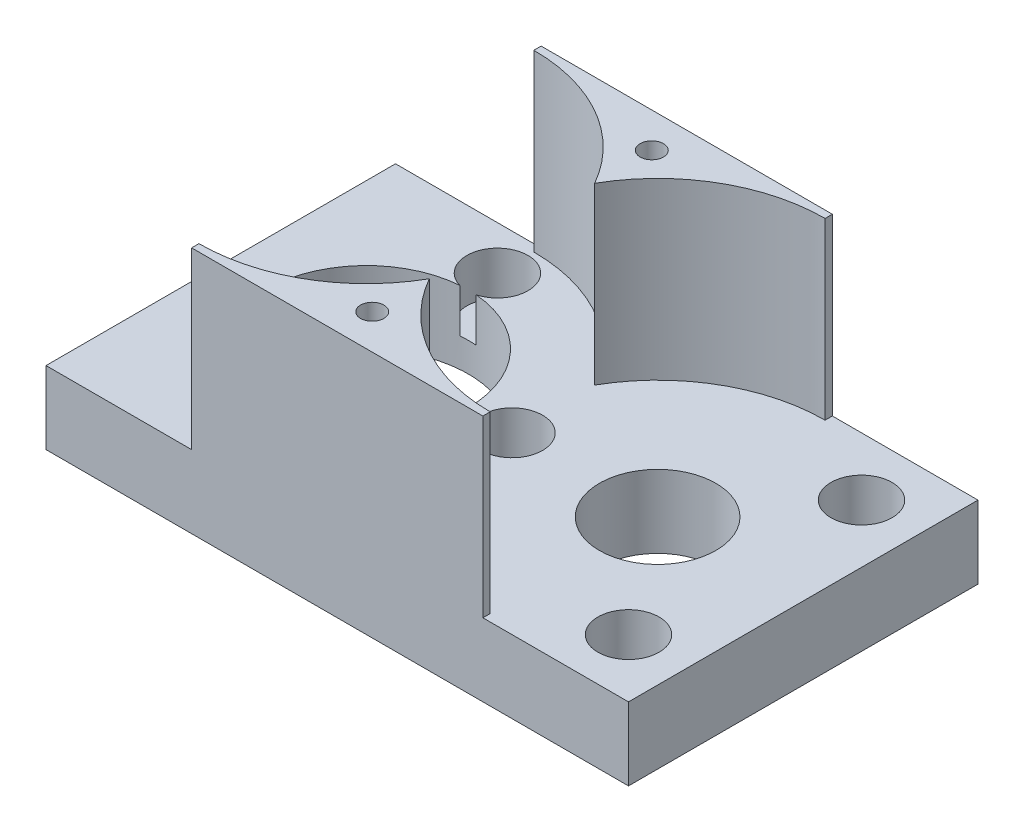
from build123d import *

# Parameters (mm, degrees)
SKETCH_1_W          = 20
SKETCH_1_H          = 12
EXTRUDE_1_DEPTH     = 2.5
SKETCH_2_R          = 2
SKETCH_2_R_2        = 3.5
CUT_EXTRUDE_1_DEPTH = 24.457408211
SKETCH_3_R          = 0.5
CUT_EXTRUDE_3_DEPTH = 24.457408211
CUT_EXTRUDE_START   = -1
SKETCH_3_4_R        = 1.05
SKETCH_3_4_R_2      = 0.5
CUT_EXTRUDE_6_DEPTH = 1.5
EXTRUDE_2_DEPTH     = 6
SKETCH_5_R          = 0.4
CUT_EXTRUDE_7_DEPTH = 2


with BuildPart() as part:
    # 草图1 → 凸台-拉伸1 (new body)
    with BuildSketch(Plane(origin=(0, 0, 0), x_dir=(1, 0, 0), z_dir=(0, 1, 0))):
        with Locations((10, 6)):
            Rectangle(SKETCH_1_W, SKETCH_1_H)
    extrude(amount=EXTRUDE_1_DEPTH)

    # 草图2 → 切除-拉伸1 (cut, through all)
    with BuildSketch(Plane(origin=(0, 2.5, 0), x_dir=(1, 0, 0), z_dir=(0, 1, 0))):
        with Locations(Location((15, 6, 0), (0, 0, 270))):
            Circle(SKETCH_2_R)
        with Locations(Location((5, 6, 0), (0, 0, 270))):
            Circle(SKETCH_2_R_2)
    extrude(amount=-CUT_EXTRUDE_1_DEPTH, mode=Mode.SUBTRACT)

    # 草图3 → 切除-拉伸3 (cut, through all)
    with BuildSketch(Plane.XZ):
        with Locations(Location((18, -2, 0), (0, 0, 270))):
            Circle(SKETCH_3_R)
        with Locations(Location((18, -10, 0), (0, 0, 270))):
            Circle(SKETCH_3_R)
        with Locations(Location((10, -6, 0), (0, 0, 270))):
            Circle(SKETCH_3_R)
        with Locations(Location((5, -1.5, 0), (0, 0, 270))):
            Circle(SKETCH_3_R)
        with Locations(Location((5, -10.5, 0), (0, 0, 270))):
            Circle(SKETCH_3_R)
    extrude(amount=-CUT_EXTRUDE_3_DEPTH, mode=Mode.SUBTRACT)

    # 草图3<4> → 切除-拉伸6 (cut)
    # profile 1 of 5: a face of its own
    with BuildSketch(Plane.XZ.offset(CUT_EXTRUDE_START)):
        with Locations((5, -10.5)):
            Circle(SKETCH_3_4_R)
        with Locations(Location((5, -10.5, 0), (0, 0, 270))):
            Circle(SKETCH_3_4_R_2, mode=Mode.SUBTRACT)
    # profile 2 of 5: a face of its own
    with BuildSketch(Plane.XZ.offset(CUT_EXTRUDE_START)):
        with Locations((5, -1.5)):
            Circle(SKETCH_3_4_R)
        with Locations(Location((5, -1.5, 0), (0, 0, 270))):
            Circle(SKETCH_3_4_R_2, mode=Mode.SUBTRACT)
    # profile 3 of 5: a face of its own
    with BuildSketch(Plane.XZ.offset(CUT_EXTRUDE_START)):
        with Locations(Location((18, -2, 0), (0, 0, 90))):
            Circle(SKETCH_3_4_R)
        with Locations(Location((18, -2, 0), (0, 0, 270))):
            Circle(SKETCH_3_4_R_2, mode=Mode.SUBTRACT)
    # profile 4 of 5: a face of its own
    with BuildSketch(Plane.XZ.offset(CUT_EXTRUDE_START)):
        with Locations(Location((10, -6, 0), (0, 0, 90))):
            Circle(SKETCH_3_4_R)
        with Locations(Location((10, -6, 0), (0, 0, 270))):
            Circle(SKETCH_3_4_R_2, mode=Mode.SUBTRACT)
    # profile 5 of 5: a face of its own
    with BuildSketch(Plane.XZ.offset(CUT_EXTRUDE_START)):
        with Locations(Location((18, -10, 0), (0, 0, 90))):
            Circle(SKETCH_3_4_R)
        with Locations(Location((18, -10, 0), (0, 0, 270))):
            Circle(SKETCH_3_4_R_2, mode=Mode.SUBTRACT)
    extrude(amount=-CUT_EXTRUDE_6_DEPTH, mode=Mode.SUBTRACT)

    # 草图4 → 凸台-拉伸2 (add)
    with BuildSketch(Plane(origin=(0, 2.5, 0), x_dir=(1, 0, 0), z_dir=(0, 1, 0))):
        with BuildLine():
            Line((15, 11.75), (15, 12))
            Line((15, 12), (5, 12))
            Line((5, 12), (5, 11.75))
            ThreePointArc((5, 11.75), (7.892718316, 10.969374281), (10, 8.839454173))
            ThreePointArc((10, 8.839454173), (12.107281684, 10.969374281), (15, 11.75))
        make_face()
        with BuildLine():
            Line((15, 0), (15, 0.25))
            ThreePointArc((15, 0.25), (12.107281684, 1.030625719), (10, 3.160545827))
            ThreePointArc((10, 3.160545827), (7.892718316, 1.030625719), (5, 0.25))
            Line((5, 0.25), (5, 0))
            Line((5, 0), (15, 0))
        make_face()
    extrude(amount=EXTRUDE_2_DEPTH)

    # 草图5 → 切除-拉伸7 (cut)
    with BuildSketch(Plane(origin=(0, 8.5, 0), x_dir=(1, 0, 0), z_dir=(0, 1, 0))):
        with Locations(Location((10, 1.2, 0), (0, 0, 270))):
            Circle(SKETCH_5_R)
        with Locations(Location((10, 10.8, 0), (0, 0, 270))):
            Circle(SKETCH_5_R)
    extrude(amount=-CUT_EXTRUDE_7_DEPTH, mode=Mode.SUBTRACT)


solid = part.part
